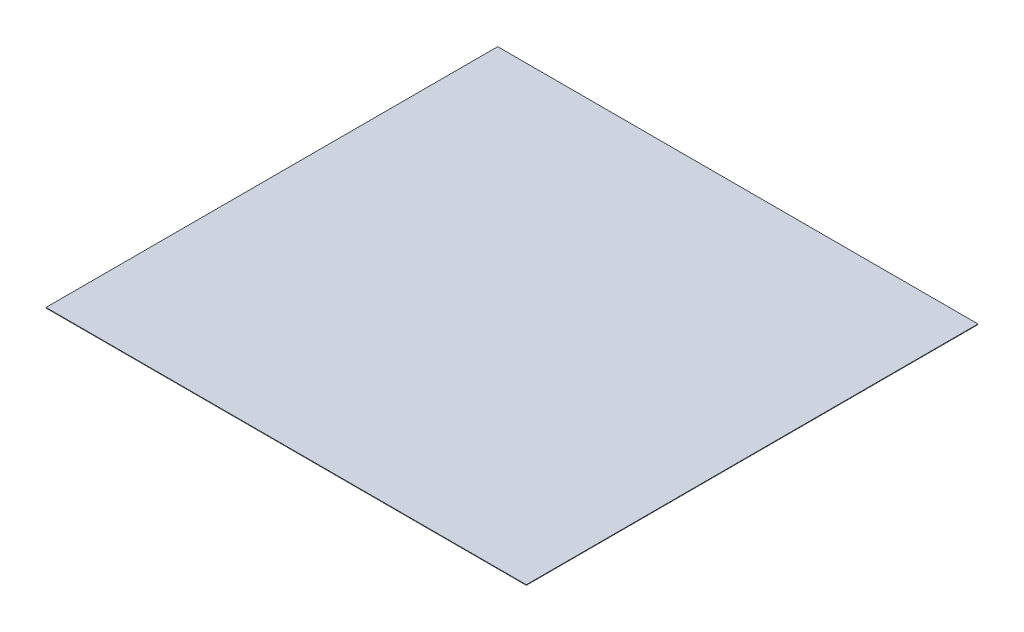
from build123d import *

# Parameters (mm, degrees)
SUPERFICIE_EXTRUIR1_1_DEPTH = 420
DAR_ESPESOR1_T2             = 0.5


with BuildPart() as body_1:
    # Superficie-Extruir1: a surface, the sketch's curves swept straight by 420 mm
    with BuildLine(Plane.XY, mode=Mode.PRIVATE) as superficie_extruir1_1_path:
        Line((0, 0), (446.64, 0))
    superficie_extruir1_1 = Shell.extrude(superficie_extruir1_1_path.wire(), (0 * SUPERFICIE_EXTRUIR1_1_DEPTH, 0 * SUPERFICIE_EXTRUIR1_1_DEPTH, 1 * SUPERFICIE_EXTRUIR1_1_DEPTH))
    add(Solid.thicken(superficie_extruir1_1, -DAR_ESPESOR1_T2))


solid = body_1.part
